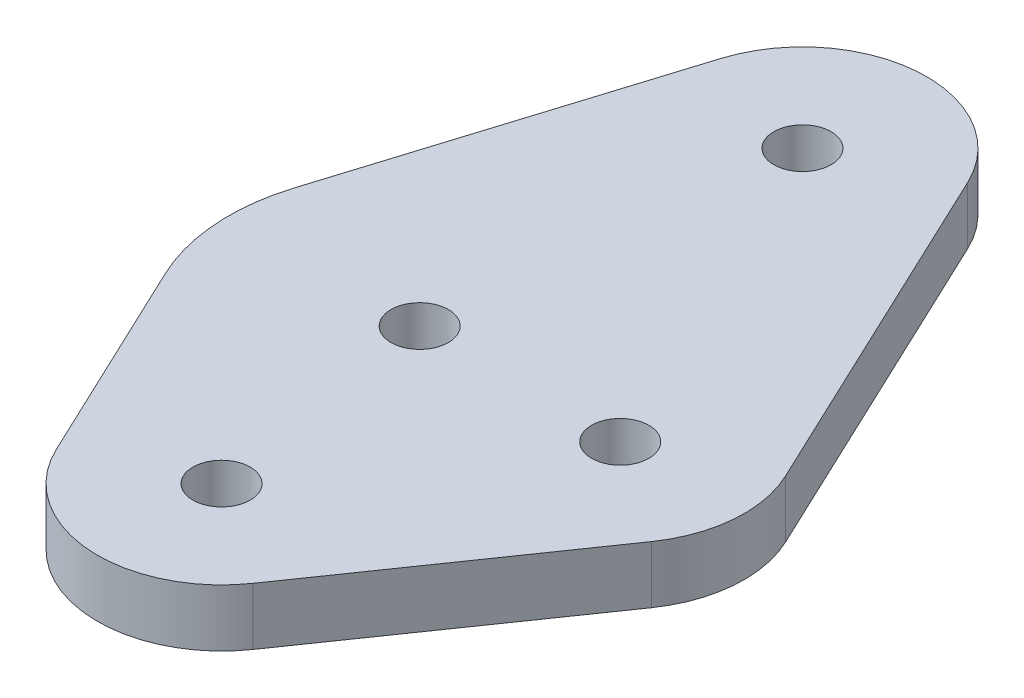
from build123d import *

# Parameters (mm, degrees)
SKETCH_1_R      = 1.5
EXTRUDE_1_DEPTH = 3


with BuildPart() as part:
    # ｽｹｯﾁ1 → ﾎﾞｽ - 押し出し1 (new body)
    with BuildSketch(Plane(origin=(0, 0, 0), x_dir=(1, 0, 0), z_dir=(0, 1, 0))):
        with BuildLine():
            Line((-2.665158166, 20.860175741), (5.877263796, 2.776287138))
            ThreePointArc((5.877263796, 2.776287138), (6.478003321, -0.534296709), (5.342967087, -3.701716183))
            Line((5.342967087, -3.701716183), (-3.199454874, -16.031640231))
            ThreePointArc((-3.199454874, -16.031640231), (-9.075729345, -18.808008891), (-14.418837496, -15.108006205))
            Line((-14.418837496, -15.108006205), (-19.540639283, -4.273972549))
            ThreePointArc((-19.540639283, -4.273972549), (-20.475455432, -0.700206348), (-20.049052246, 2.969107814))
            Line((-20.049052246, 2.969107814), (-14.749305921, 20.013808683))
            ThreePointArc((-14.749305921, 20.013808683), (-8.99656584, 24.568004067), (-2.665158166, 20.860175741))
        make_face()
        with Locations(Location((0, 0, 0), (0, 0, 270))):
            Circle(SKETCH_1_R, mode=Mode.SUBTRACT)
        with Locations(Location((-8.542421962, 18.083888604, 0), (0, 0, 270))):
            Circle(SKETCH_1_R, mode=Mode.SUBTRACT)
        with Locations(Location((-8.542421962, -12.329924048, 0), (0, 0, 270))):
            Circle(SKETCH_1_R, mode=Mode.SUBTRACT)
        with Locations(Location((-10.5, 0, 0), (0, 0, 270))):
            Circle(SKETCH_1_R, mode=Mode.SUBTRACT)
    extrude(amount=EXTRUDE_1_DEPTH)


solid = part.part
